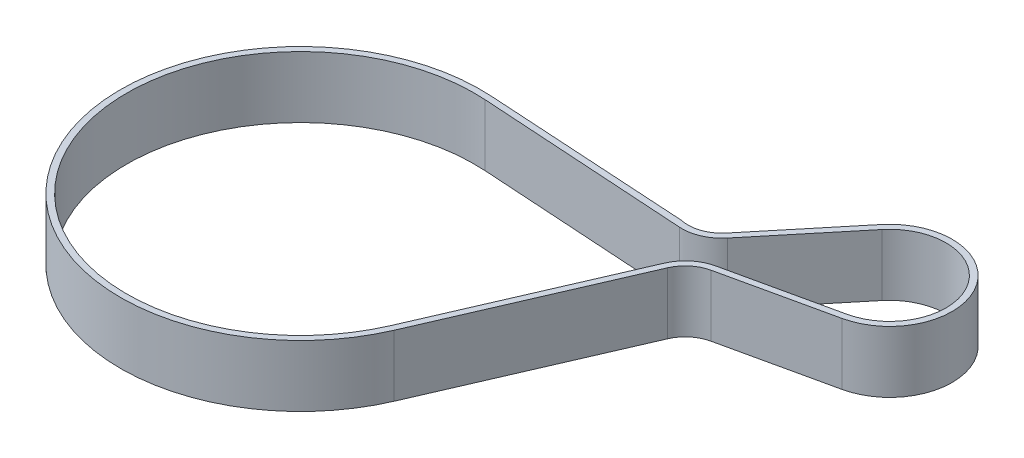
from build123d import *

# Parameters (mm, degrees)
BOSS_EXTRUDE1_DEPTH = 7
BOSS_EXTRUDE2_DEPTH = 3


with BuildPart() as part:
    # Sketch1 → Boss-Extrude1 (new body)
    with BuildSketch(Plane(origin=(0, 0, 0), x_dir=(1, 0, 0), z_dir=(0, 1, 0))):
        with BuildLine():
            Line((29.22824924, 30.681159688), (17.850659856, 16.897054356))
            ThreePointArc((17.850659856, 16.897054356), (15.379675631, 15.1910369), (12.380917697, 15.03705815))
            Line((12.380917697, 15.03705815), (-20.537634361, 17.060906053))
            ThreePointArc((-20.537634361, 17.060906053), (-47.281869491, -27.461627718), (4.525488573, -23.786335009))
            Line((4.525488573, -23.786335009), (17.958953394, 7.231589211))
            ThreePointArc((17.958953394, 7.231589211), (19.505297976, 9.287886756), (21.817685297, 10.415896524))
            Line((21.817685297, 10.415896524), (39.268754989, 14.277407445))
            ThreePointArc((39.268754989, 14.277407445), (45.745634232, 29.516516233), (29.22824924, 30.681159688))
        make_face()
        with BuildLine():
            ThreePointArc((3.607850555, -23.388917762), (-46.445589463, -26.91243355), (-20.537634361, 16.058950924))
            Line((-20.537634361, 16.058950924), (13.195989156, 13.911337267))
            ThreePointArc((13.195989156, 13.911337267), (16.191497408, 14.433261737), (18.621876492, 16.260481579))
            Line((18.621876492, 16.260481579), (29.999465876, 30.044586911))
            ThreePointArc((29.999465876, 30.044586911), (44.89272255, 28.994461003), (39.05270459, 15.253789658))
            Line((39.05270459, 15.253789658), (21.601634898, 11.392278737))
            ThreePointArc((21.601634898, 11.392278737), (18.868813518, 10.059176283), (17.041315376, 7.629006457))
            Line((17.041315376, 7.629006457), (3.607850555, -23.388917762))
        make_face(mode=Mode.SUBTRACT)
    extrude(amount=BOSS_EXTRUDE1_DEPTH)

    # Sketch2 → Boss-Extrude2 (add)
    with BuildSketch(Plane(origin=(0, 7, 0), x_dir=(1, 0, 0), z_dir=(0, 1, 0))):
        with BuildLine():
            Line((21.817685297, 10.415896524), (39.268754989, 14.277407445))
            ThreePointArc((39.268754989, 14.277407445), (45.745634232, 29.516516233), (29.22824924, 30.681159688))
            Line((29.22824924, 30.681159688), (17.850659856, 16.897054356))
            ThreePointArc((17.850659856, 16.897054356), (15.379675631, 15.1910369), (12.380917697, 15.03705815))
            Line((12.380917697, 15.03705815), (-20.537634361, 17.060906053))
            ThreePointArc((-20.537634361, 17.060906053), (-47.281869491, -27.461627718), (4.525488573, -23.786335009))
            Line((4.525488573, -23.786335009), (17.958953394, 7.231589211))
            ThreePointArc((17.958953394, 7.231589211), (19.505297976, 9.287886756), (21.817685297, 10.415896524))
        make_face()
        with BuildLine():
            Line((17.041315376, 7.629006457), (3.607850555, -23.388917762))
            ThreePointArc((3.607850555, -23.388917762), (-46.445589463, -26.91243355), (-20.537634361, 16.058950924))
            Line((-20.537634361, 16.058950924), (13.195989156, 13.911337267))
            ThreePointArc((13.195989156, 13.911337267), (16.191497408, 14.433261737), (18.621876492, 16.260481579))
            Line((18.621876492, 16.260481579), (29.999465876, 30.044586911))
            ThreePointArc((29.999465876, 30.044586911), (44.89272255, 28.994461003), (39.05270459, 15.253789658))
            Line((39.05270459, 15.253789658), (21.601634898, 11.392278737))
            ThreePointArc((21.601634898, 11.392278737), (18.868813518, 10.059176283), (17.041315376, 7.629006457))
        make_face(mode=Mode.SUBTRACT)
    extrude(amount=BOSS_EXTRUDE2_DEPTH)


solid = part.part
